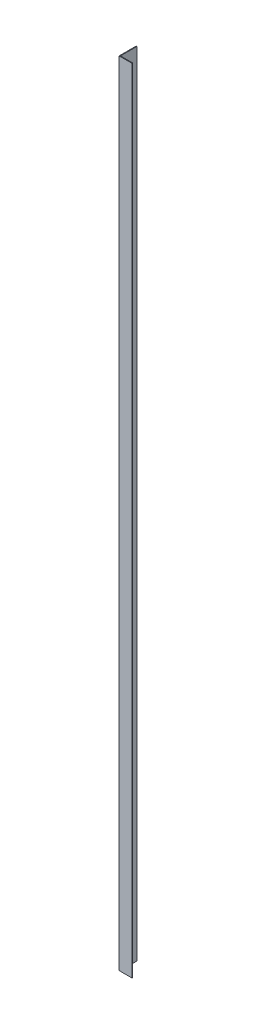
from build123d import *

# Parameters (mm, degrees)
PRESS_SOVE_SAG_1_START = 120
PRESS_SOVE_SAG_1_DEPTH = 1850


with BuildPart() as part:
    # Sketch1 → PRESS_sove_sag_1 (new body)
    with BuildSketch(Plane(origin=(0, 0, 0), x_dir=(1, 0, 0), z_dir=(0, 1, 0)).offset(PRESS_SOVE_SAG_1_START)):
        Polygon((700, -40), (700, -38.5), (671.5, -38.5), (671.5, 0), (670, 0), (670, -40), align=None)
    extrude(amount=PRESS_SOVE_SAG_1_DEPTH)


solid = part.part
